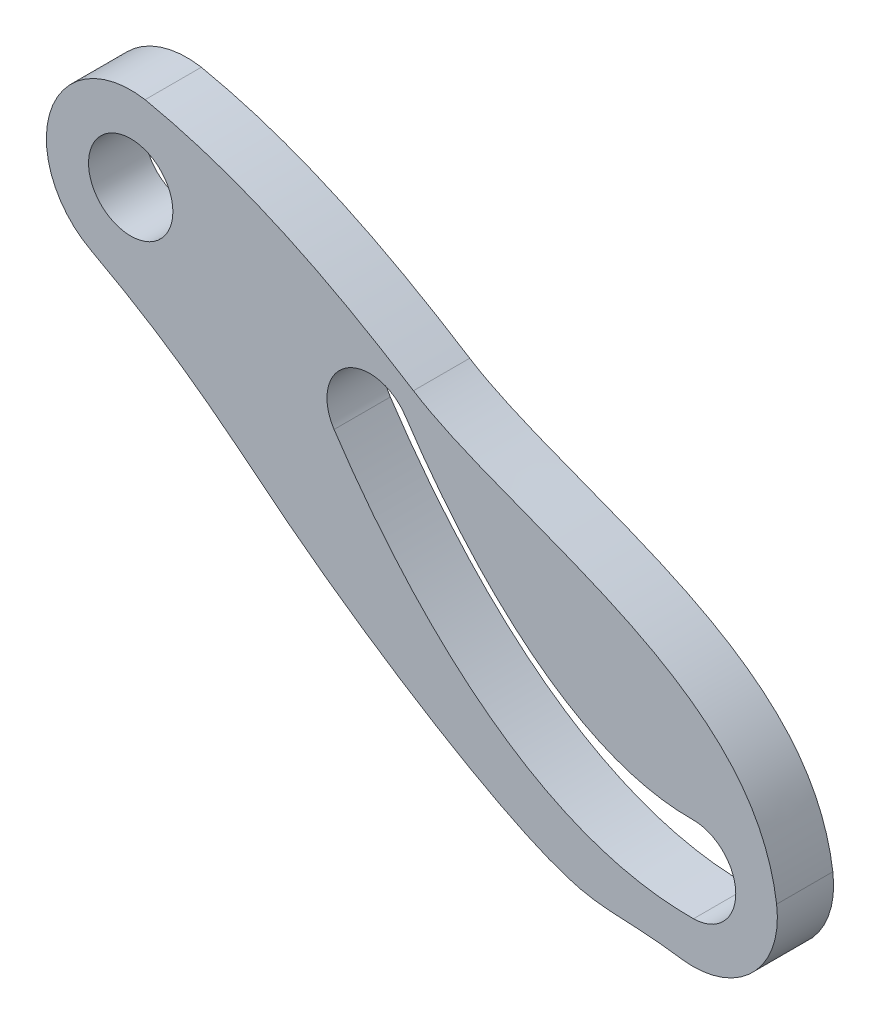
from build123d import *

# Parameters (mm, degrees)
SKETCH_1_R          = 1.5
EXTRUDE_1_DEPTH     = 2
EXTRUDE_START       = -2
EXTRUDE_2_DEPTH     = 2
CUT_EXTRUDE_6_DEPTH = 10
EXTRUDE_3_DEPTH     = 2


with BuildPart() as part:
    # 草图1 → 凸台-拉伸1 (new body)
    with BuildSketch(Plane.XY):
        with BuildLine():
            add(Edge.make_bspline(
                [(-7.987888182, 5.955967098), (-3.743831448, 6.072814335), (1.964500208, 2.606366835), (9.971098404, -1.64370968), (11.281519782, -4.915475191), (12.099924554, -5.060596909)],
                knots=[0, 0, 0, 0, 0.492049643, 0.9167731, 1, 1, 1, 1], degree=3))
            ThreePointArc((-7.987888182, 5.955967098), (-11.335902649, 3.978599082), (-9.919857427, 0.35727321))
            add(Edge.make_bspline(
                [(-9.919857427, 0.35727321), (-6.214513301, -1.633496474), (-3.207757144, -4.777239805), (7.078147627, -11.27345607), (9.126976019, -10.694820948), (11.080759462, -10.970561794)],
                knots=[0, 0, 0, 0, 0.359134016, 0.783116461, 1, 1, 1, 1], degree=3))
            ThreePointArc((11.080759462, -10.970561794), (14.456363123, -8.509820643), (12.099924554, -5.060596909))
        make_face()
        with BuildLine():
            ThreePointArc((-1.266260939, -0.840822951), (-0.840822951, 1.266260939), (1.266260939, 0.840822951))
            add(Edge.make_bspline(
                [(1.266260939, 0.840822951), (1.572421217, 0.37975228), (2.2006023, -0.51199535), (3.651531179, -2.318328255), (5.731244794, -4.36936802), (8.515750536, -6.078268968), (10.483635949, -6.491801521), (11.482195768, -6.480104277)],
                knots=[0, 0, 0, 0, 0.125, 0.25, 0.5, 0.75, 1, 1, 1, 1], degree=3))
            ThreePointArc((11.482195768, -6.480104277), (12.568489019, -6.918921272), (13.02, -8))
            ThreePointArc((13.02, -8), (12.581078728, -9.068489019), (11.517804232, -9.519895723))
            add(Edge.make_bspline(
                [(-1.266260939, -0.840822951), (-0.926702959, -1.352189828), (-0.233155533, -2.337077502), (1.395542848, -4.364895632), (3.78940322, -6.741408475), (6.71258634, -8.559402396), (9.358185118, -9.384824122), (10.805124931, -9.52824413), (11.517804232, -9.519895723)],
                knots=[0, 0, 0, 0, 0.125, 0.25, 0.5, 0.75, 0.875, 1, 1, 1, 1], degree=3))
        make_face(mode=Mode.SUBTRACT)
        with Locations((-8.5, 3)):
            Circle(SKETCH_1_R, mode=Mode.SUBTRACT)
    extrude(amount=EXTRUDE_1_DEPTH)

    # 草图2 → 凸台-拉伸2 (add)
    with BuildSketch(Plane.XY.offset(2).offset(EXTRUDE_START)):
        with BuildLine():
            ThreePointArc((12.382013346, -5.132587847), (12.241842746, -5.093168505), (12.099924554, -5.060596909))
            add(Edge.make_bspline(
                [(12.099924554, -5.060596909), (11.281519782, -4.915475191), (10.976298239, -4.153420073), (10.521531787, -3.451743028), (10.374807656, -3.248589277)],
                knots=[0, 0, 0, 0, 0.0832269, 0.118311098, 0.118311098, 0.118311098, 0.118311098], degree=3))
            add(Edge.make_bspline(
                [(10.374807656, -3.248589277), (10.663783201, -3.648703868), (11.898898367, -4.983982122), (12.382013346, -5.132587847)],
                knots=[0, 0, 0, 0, 1, 1, 1, 1], degree=3))
        make_face()
    extrude(amount=EXTRUDE_2_DEPTH)

    # 草图7 → 切除-拉伸6 (cut)
    with BuildSketch(Plane.XY.offset(2)):
        with BuildLine():
            Line((-7.987888182, 5.955967098), (1.266062019, 11.163030358))
            Line((1.266062019, 11.163030358), (12.382013346, -5.132587847))
            add(Edge.make_bspline(
                [(-7.987888182, 5.955967098), (-0.077844738, 4.310798263), (5.452050398, -1.616496795), (12.382013346, -5.132587847)],
                knots=[0, 0, 0, 0, 1, 1, 1, 1], degree=3))
        make_face()
    extrude(amount=-CUT_EXTRUDE_6_DEPTH, mode=Mode.SUBTRACT)

    # 草图8 → 凸台-拉伸3 (add)
    with BuildSketch(Plane.XY.offset(2).offset(EXTRUDE_START)):
        with BuildLine():
            ThreePointArc((14.472568825, -7.595235155), (13.787052442, -6.058508015), (12.382013346, -5.132587847))
            add(Edge.make_bspline(
                [(12.382013346, -5.132587847), (12.317985887, -5.112893059), (12.24075005, -5.072355166), (12.154258782, -5.015913393)],
                knots=[0, 0, 0, 0, 0.132530478, 0.132530478, 0.132530478, 0.132530478], degree=3))
            add(Edge.make_bspline(
                [(12.154258782, -5.015913393), (8.423758186, -3.086650873), (5.090409864, -0.473998081), (1.556721967, 1.76411334)],
                knots=[0, 0, 0, 0, 0.540677693, 0.540677693, 0.540677693, 0.540677693], degree=3))
            add(Edge.make_bspline(
                [(1.556721967, 1.76411334), (4.495628992, -0.097285168), (12.132556571, -1.344060553), (14.312894291, -6.422594924), (14.472568825, -7.595235155)],
                knots=[0, 0, 0, 0, 0.805722027, 1, 1, 1, 1], degree=3))
        make_face()
    extrude(amount=EXTRUDE_3_DEPTH)


solid = part.part
